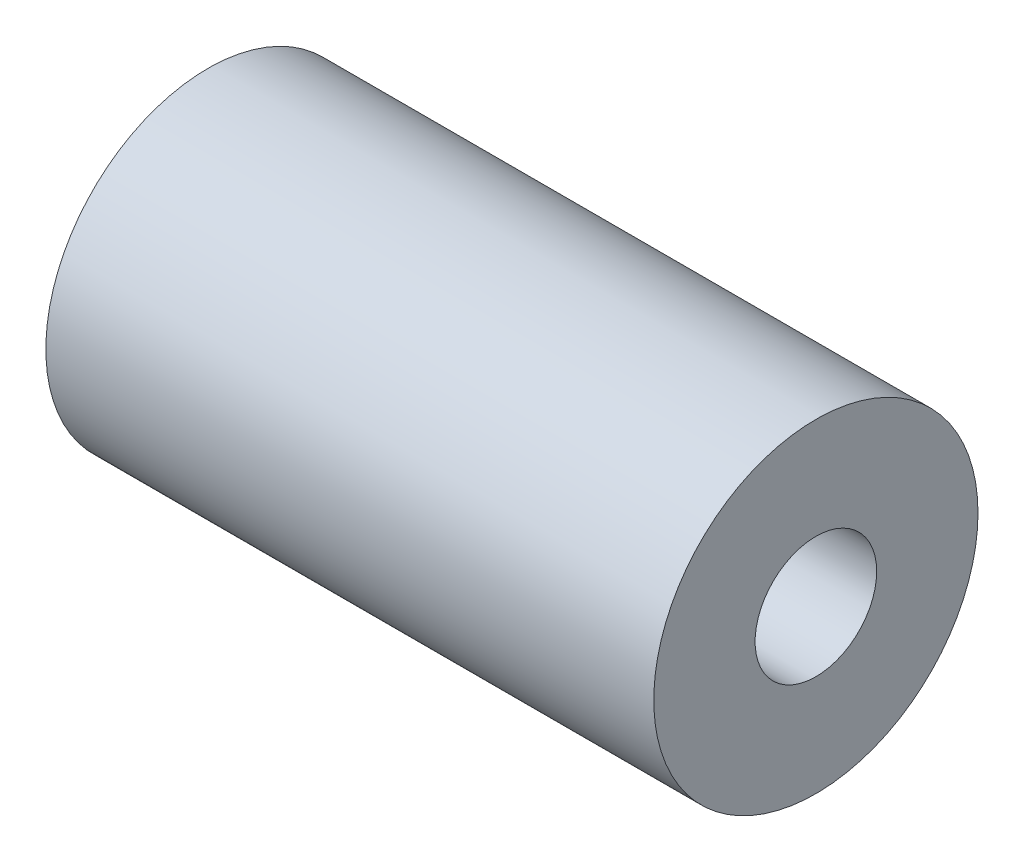
from build123d import *

# Parameters (mm, degrees)
SKETCH1_R           = 4
SKETCH1_R_2         = 1.5
BOSS_EXTRUDE1_DEPTH = 15


with BuildPart() as part:
    # Sketch1 → Boss-Extrude1 (new body)
    with BuildSketch(Plane(origin=(0, 0, 0), x_dir=(0, 0, -1), z_dir=(1, 0, 0))):
        Circle(SKETCH1_R)
        Circle(SKETCH1_R_2, mode=Mode.SUBTRACT)
    extrude(amount=BOSS_EXTRUDE1_DEPTH)


solid = part.part
